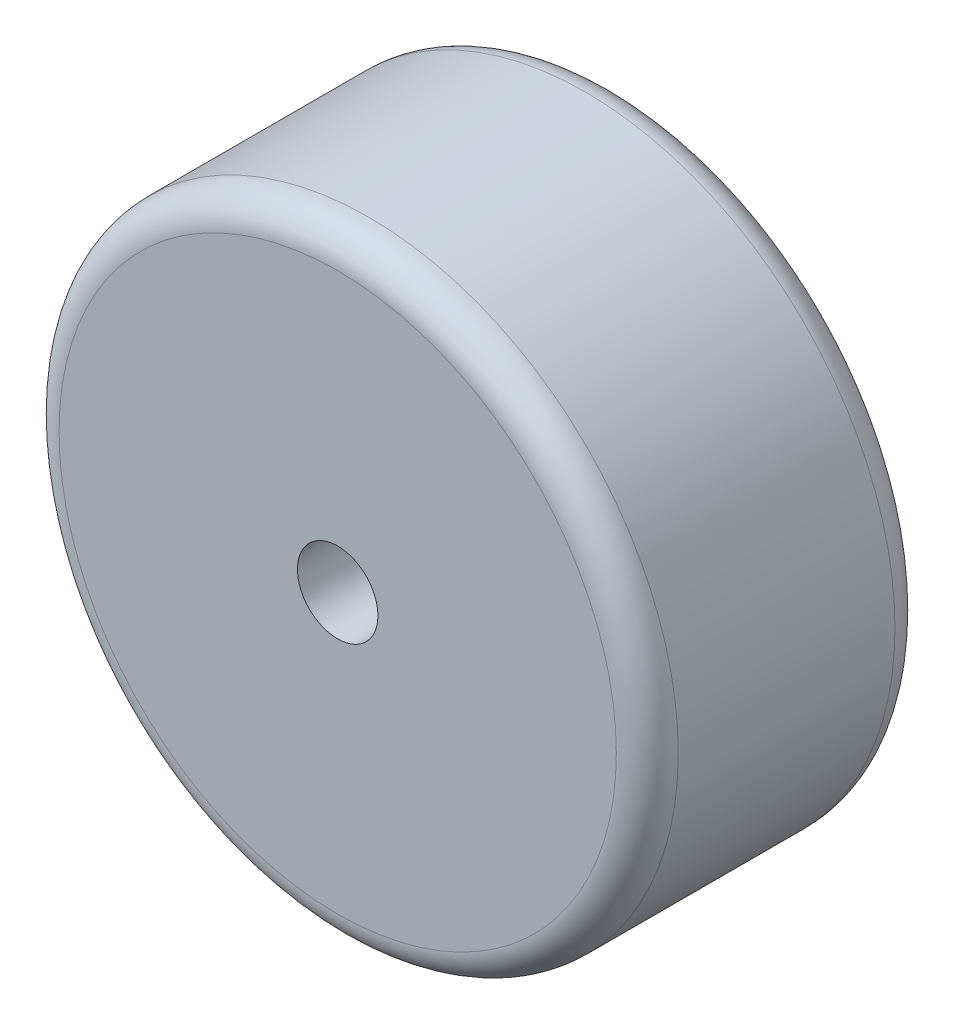
from build123d import *

# Parameters (mm, degrees)
ESQUISSE1_R      = 5
ESQUISSE1_R_2    = 0.65
EXTRUSION1_DEPTH = 4.5
CONG_1_R         = 0.5


with BuildPart() as part:
    # Esquisse1 → Extrusion1 (new body)
    with BuildSketch(Plane.XY):
        Circle(ESQUISSE1_R)
        Circle(ESQUISSE1_R_2, mode=Mode.SUBTRACT)
    extrude(amount=EXTRUSION1_DEPTH)

    # Congé1
    cong_1_edges = [part.edges().sort_by_distance(p)[0] for p in [
        (-5, 0, 0),
        (-5, 0, 4.5),
    ]]
    fillet(cong_1_edges, radius=CONG_1_R)


solid = part.part
